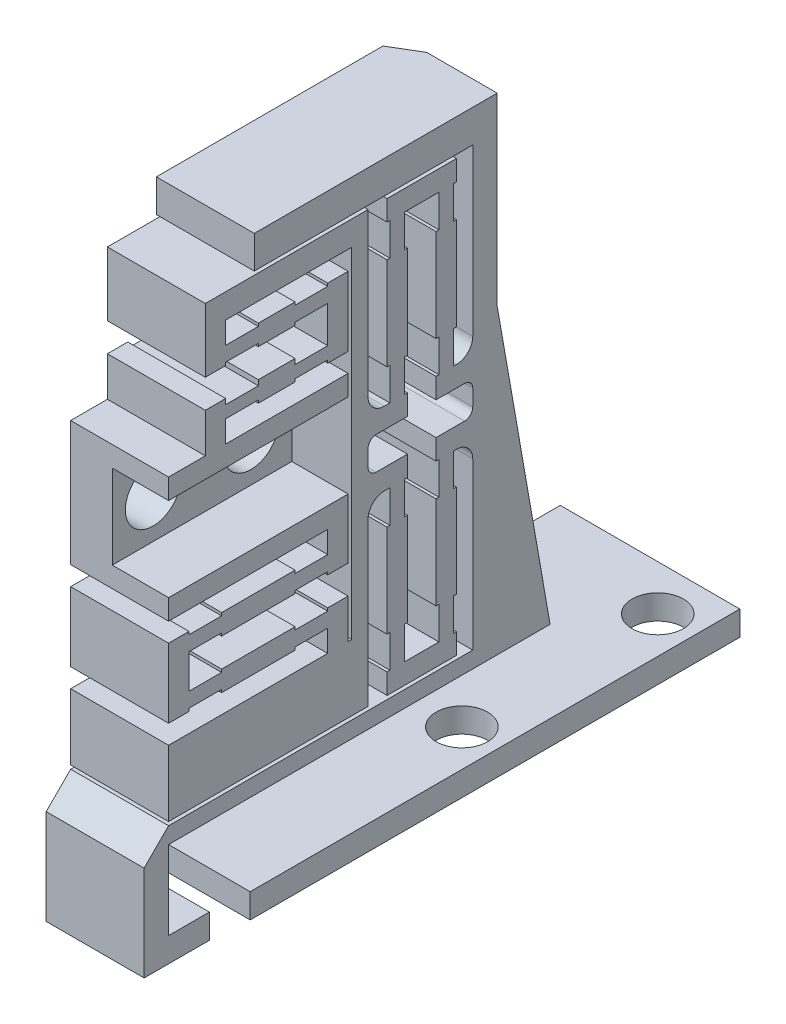
from build123d import *

# Parameters (mm, degrees)
BOSS_EXTRUDE1_DEPTH = 6
CUT_EXTRUDE4_REACH  = 45.595
SKETCH2_W           = 3.45
SKETCH2_H           = 5.15
CUT_EXTRUDE3_REACH  = 42.987
SKETCH7_R           = 1.7
SKETCH3_W           = 11
SKETCH3_H           = 30
SKETCH3_R           = 1.575
BOSS_EXTRUDE2_DEPTH = 1.5
CHAMFER1_SIZE       = 1
CHAMFER1_SIZE2      = 1.679514399


with BuildPart() as part:
    # Sketch1 → Boss-Extrude1 (new body)
    with BuildSketch(Plane(origin=(0, 0, 0), x_dir=(0, 0, -1), z_dir=(1, 0, 0))):
        with BuildLine():
            Line((-5.25, -10.303333333), (-5.25, -17.953333333))
            Line((-5.25, -17.953333333), (4.5, -17.953333333))
            Line((4.5, -17.953333333), (4.5, -19.295))
            Line((4.5, -19.295), (2.5, -19.295))
            Line((2.5, -19.295), (2.5, -19.12))
            Line((2.5, -19.12), (-2, -19.12))
            Line((-2, -19.12), (-2, -19.295))
            Line((-2, -19.295), (-4, -19.295))
            Line((-4, -19.295), (-4, -19.12))
            Line((-4, -19.12), (-5.25, -19.12))
            Line((-5.25, -19.12), (-5.25, -23.37))
            Line((-5.25, -23.37), (-4, -23.37))
            Line((-4, -23.37), (-4, -23.195))
            Line((-4, -23.195), (-2, -23.195))
            Line((-2, -23.195), (-2, -23.37))
            Line((-2, -23.37), (2.5, -23.37))
            Line((2.5, -23.37), (2.5, -23.195))
            Line((2.5, -23.195), (4.5, -23.195))
            Line((4.5, -23.195), (4.5, -24.536666667))
            Line((4.5, -24.536666667), (-5.25, -24.536666667))
            Line((-5.25, -24.536666667), (-5.25, -28.58666667))
            Line((-5.25, -28.58666667), (6.97, -28.58666667))
            Line((6.97, -28.58666667), (6.97, -18.653333335))
            ThreePointArc((6.97, -18.653333335), (7.262893219, -17.946226554), (7.97, -17.653333335))
            Line((7.97, -17.653333335), (8.311666667, -17.653333335))
            Line((8.311666667, -17.653333335), (8.311666667, -19.653333335))
            Line((8.311666667, -19.653333335), (8.136666667, -19.653333335))
            Line((8.136666667, -19.653333335), (8.136666667, -25.33666667))
            Line((8.136666667, -25.33666667), (8.311666667, -25.33666667))
            Line((8.311666667, -25.33666667), (8.311666667, -27.33666667))
            Line((8.311666667, -27.33666667), (8.136666667, -27.33666667))
            Line((8.136666667, -27.33666667), (8.136666667, -28.58666667))
            Line((8.136666667, -28.58666667), (12.386666667, -28.58666667))
            Line((12.386666667, -28.58666667), (12.386666667, -27.33666667))
            Line((12.386666667, -27.33666667), (12.211666667, -27.33666667))
            Line((12.211666667, -27.33666667), (12.211666667, -25.33666667))
            Line((12.211666667, -25.33666667), (12.386666667, -25.33666667))
            Line((12.386666667, -25.33666667), (12.386666667, -19.653333335))
            Line((12.386666667, -19.653333335), (12.211666667, -19.653333335))
            Line((12.211666667, -19.653333335), (12.211666667, -17.653333335))
            Line((12.211666667, -17.653333335), (12.386666667, -17.653333335))
            ThreePointArc((12.386666667, -17.653333335), (13.093773448, -17.946226554), (13.386666667, -18.653333335))
            Line((13.386666667, -18.653333335), (13.386666667, -28.80666667))
            Line((13.386666667, -28.80666667), (-5.25, -28.80666667))
            Line((-5.25, -28.80666667), (-6.75, -30.30666667))
            Line((-6.75, -30.30666667), (-6.75, -36.13666667))
            Line((-6.75, -36.13666667), (-2.75, -36.13666667))
            Line((-2.75, -36.13666667), (-2.75, -34.63666667))
            Line((-2.75, -34.63666667), (-5.25, -34.63666667))
            Line((-5.25, -34.63666667), (-5.25, -31.30666667))
            Line((-5.25, -31.30666667), (18.386666667, -31.30666667))
            Line((18.386666667, -31.30666667), (14.886666667, -11.30666667))
            Line((14.886666667, -11.30666667), (14.886666667, 0))
            Line((14.886666667, 0), (0, 0))
            Line((0, 0), (0, -2))
            Line((0, -2), (13.386666667, -2))
            Line((13.386666667, -2), (13.386666667, -12.153333335))
            ThreePointArc((13.386666667, -12.153333335), (13.093773448, -12.860440116), (12.386666667, -13.153333335))
            Line((12.386666667, -13.153333335), (12.211666667, -13.153333335))
            Line((12.211666667, -13.153333335), (12.211666667, -11.153333335))
            Line((12.211666667, -11.153333335), (12.386666667, -11.153333335))
            Line((12.386666667, -11.153333335), (12.386666667, -5.47))
            Line((12.386666667, -5.47), (12.211666667, -5.47))
            Line((12.211666667, -5.47), (12.211666667, -3.47))
            Line((12.211666667, -3.47), (12.386666667, -3.47))
            Line((12.386666667, -3.47), (12.386666667, -2.22))
            Line((12.386666667, -2.22), (8.136666667, -2.22))
            Line((8.136666667, -2.22), (8.136666667, -3.47))
            Line((8.136666667, -3.47), (8.311666667, -3.47))
            Line((8.311666667, -3.47), (8.311666667, -5.47))
            Line((8.311666667, -5.47), (8.136666667, -5.47))
            Line((8.136666667, -5.47), (8.136666667, -11.153333335))
            Line((8.136666667, -11.153333335), (8.311666667, -11.153333335))
            Line((8.311666667, -11.153333335), (8.311666667, -13.153333335))
            Line((8.311666667, -13.153333335), (7.97, -13.153333335))
            ThreePointArc((7.97, -13.153333335), (7.262893219, -12.860440116), (6.97, -12.153333335))
            Line((6.97, -12.153333335), (6.97, -2.22))
            Line((6.97, -2.22), (-3, -2.22))
            Line((-3, -2.22), (-3, -6.136666667))
            Line((-3, -6.136666667), (-1.75, -6.136666667))
            Line((-1.75, -6.136666667), (-1.75, -5.961666667))
            Line((-1.75, -5.961666667), (0.25, -5.961666667))
            Line((0.25, -5.961666667), (0.25, -6.136666667))
            Line((0.25, -6.136666667), (2.5, -6.136666667))
            Line((2.5, -6.136666667), (2.5, -5.961666667))
            Line((2.5, -5.961666667), (4.5, -5.961666667))
            Line((4.5, -5.961666667), (4.5, -8.211666667))
            Line((4.5, -8.211666667), (2.5, -8.211666667))
            Line((2.5, -8.211666667), (2.5, -7.886666667))
            Line((2.5, -7.886666667), (0.25, -7.886666667))
            Line((0.25, -7.886666667), (0.25, -8.211666667))
            Line((0.25, -8.211666667), (-1.75, -8.211666667))
            Line((-1.75, -8.211666667), (-1.75, -7.886666667))
            Line((-1.75, -7.886666667), (-3, -7.886666667))
            Line((-3, -7.886666667), (-3, -10.303333333))
            Line((-3, -10.303333333), (-5.25, -10.303333333))
        make_face()
        Polygon((-1.75, -10.303333333), (5.75, -10.303333333), (5.75, -20.37), (4.5, -20.37), (4.5, -20.195), (2.5, -20.195), (2.5, -20.37), (-2, -20.37), (-2, -20.195), (-4, -20.195), (-4, -22.295), (-2, -22.295), (-2, -22.12), (2.5, -22.12), (2.5, -22.295), (4.5, -22.295), (4.5, -22.12), (5.75, -22.12), (5.75, -24.536666667), (5.97, -24.536666667), (5.97, -3.72), (-1.75, -3.72), (-1.75, -5.061666667), (0.25, -5.061666667), (0.25, -4.886666667), (2.5, -4.886666667), (2.5, -5.061666667), (4.5, -5.061666667), (4.5, -4.886666667), (5.75, -4.886666667), (5.75, -9.136666667), (4.5, -9.136666667), (4.5, -8.961666667), (2.5, -8.961666667), (2.5, -9.136666667), (0.25, -9.136666667), (0.25, -8.961666667), (-1.75, -8.961666667), align=None, mode=Mode.SUBTRACT)
        with BuildLine():
            Line((11.311666667, -27.33666667), (9.211666667, -27.33666667))
            Line((9.211666667, -27.33666667), (9.211666667, -25.33666667))
            Line((9.211666667, -25.33666667), (9.386666667, -25.33666667))
            Line((9.386666667, -25.33666667), (9.386666667, -19.653333335))
            Line((9.386666667, -19.653333335), (9.211666667, -19.653333335))
            Line((9.211666667, -19.653333335), (9.211666667, -17.653333335))
            Line((9.211666667, -17.653333335), (9.386666667, -17.653333335))
            Line((9.386666667, -17.653333335), (9.386666667, -16.403333335))
            Line((9.386666667, -16.403333335), (7.47, -16.403333335))
            ThreePointArc((7.47, -16.403333335), (7.116446609, -16.256886726), (6.97, -15.903333335))
            Line((6.97, -15.903333335), (6.97, -14.903333335))
            ThreePointArc((6.97, -14.903333335), (7.116446609, -14.549779944), (7.47, -14.403333335))
            Line((7.47, -14.403333335), (9.386666667, -14.403333335))
            Line((9.386666667, -14.403333335), (9.386666667, -13.153333335))
            Line((9.386666667, -13.153333335), (9.211666667, -13.153333335))
            Line((9.211666667, -13.153333335), (9.211666667, -11.153333335))
            Line((9.211666667, -11.153333335), (9.386666667, -11.153333335))
            Line((9.386666667, -11.153333335), (9.386666667, -5.47))
            Line((9.386666667, -5.47), (9.211666667, -5.47))
            Line((9.211666667, -5.47), (9.211666667, -3.47))
            Line((9.211666667, -3.47), (11.311666667, -3.47))
            Line((11.311666667, -3.47), (11.311666667, -5.47))
            Line((11.311666667, -5.47), (11.136666667, -5.47))
            Line((11.136666667, -5.47), (11.136666667, -11.153333335))
            Line((11.136666667, -11.153333335), (11.311666667, -11.153333335))
            Line((11.311666667, -11.153333335), (11.311666667, -13.153333335))
            Line((11.311666667, -13.153333335), (11.136666667, -13.153333335))
            Line((11.136666667, -13.153333335), (11.136666667, -14.403333335))
            Line((11.136666667, -14.403333335), (12.886666667, -14.403333335))
            ThreePointArc((12.886666667, -14.403333335), (13.240220057, -14.549779944), (13.386666667, -14.903333335))
            Line((13.386666667, -14.903333335), (13.386666667, -15.903333335))
            ThreePointArc((13.386666667, -15.903333335), (13.240220057, -16.256886726), (12.886666667, -16.403333335))
            Line((12.886666667, -16.403333335), (11.136666667, -16.403333335))
            Line((11.136666667, -16.403333335), (11.136666667, -17.653333335))
            Line((11.136666667, -17.653333335), (11.311666667, -17.653333335))
            Line((11.311666667, -17.653333335), (11.311666667, -19.653333335))
            Line((11.311666667, -19.653333335), (11.136666667, -19.653333335))
            Line((11.136666667, -19.653333335), (11.136666667, -25.33666667))
            Line((11.136666667, -25.33666667), (11.311666667, -25.33666667))
            Line((11.311666667, -25.33666667), (11.311666667, -27.33666667))
        make_face(mode=Mode.SUBTRACT)
    extrude(amount=BOSS_EXTRUDE1_DEPTH)

    # Sketch2 → Cut-Extrude4 (cut, up to next)
    with BuildSketch(Plane.XY.offset(5.25), mode=Mode.PRIVATE) as cut_extrude4_sk1:
        with Locations((4.275, -14.128333333)):
            Rectangle(SKETCH2_W, SKETCH2_H)
    cut_extrude4_tool1 = extrude(cut_extrude4_sk1.sketch, amount=-CUT_EXTRUDE4_REACH, mode=Mode.PRIVATE) & part.part
    add(cut_extrude4_tool1.solids().sort_by_distance((4.275, -14.128333, 5.25))[0], mode=Mode.SUBTRACT)

    # Sketch7 → Cut-Extrude3 (cut, up to next)
    with BuildSketch(Plane.ZY, mode=Mode.PRIVATE) as cut_extrude3_sk1:
        with Locations((2.75, -14.178333333)):
            Circle(SKETCH7_R)
    cut_extrude3_tool1 = extrude(cut_extrude3_sk1.sketch, amount=-CUT_EXTRUDE3_REACH, mode=Mode.PRIVATE) & part.part
    # Sketch7 → Cut-Extrude3 (cut, up to next)
    with BuildSketch(Plane.ZY, mode=Mode.PRIVATE) as cut_extrude3_sk2:
        with Locations((-3.25, -14.178333333)):
            Circle(SKETCH7_R)
    cut_extrude3_tool2 = extrude(cut_extrude3_sk2.sketch, amount=-CUT_EXTRUDE3_REACH, mode=Mode.PRIVATE) & part.part
    add(cut_extrude3_tool1.solids().sort_by_distance((0, -14.178333, 2.75))[0], mode=Mode.SUBTRACT)
    add(cut_extrude3_tool2.solids().sort_by_distance((0, -14.178333, -3.25))[0], mode=Mode.SUBTRACT)

    # Sketch3 → Boss-Extrude2 (add)
    with BuildSketch(Plane.XZ.offset(31.30666667)):
        with Locations((5.5, -9.75)):
            Rectangle(SKETCH3_W, SKETCH3_H)
        with Locations((8.74, -9.98)):
            Circle(SKETCH3_R, mode=Mode.SUBTRACT)
        with Locations((8.74, -21.98)):
            Circle(SKETCH3_R, mode=Mode.SUBTRACT)
    extrude(amount=-BOSS_EXTRUDE2_DEPTH)

    # Chamfer1
    chamfer1_edges = [part.edges().sort_by_distance(p)[0] for p in [
        (0, -20.55666667, -16.505416667),
        (0, -5.653333335, -14.886666667),
    ]]
    chamfer1_side = [part.faces().sort_by_distance(p)[0] for p in [
        (0, -10.782719261, 4.125),
    ]]
    chamfer(chamfer1_edges, length=CHAMFER1_SIZE, length2=CHAMFER1_SIZE2, reference=chamfer1_side[0])


solid = part.part
